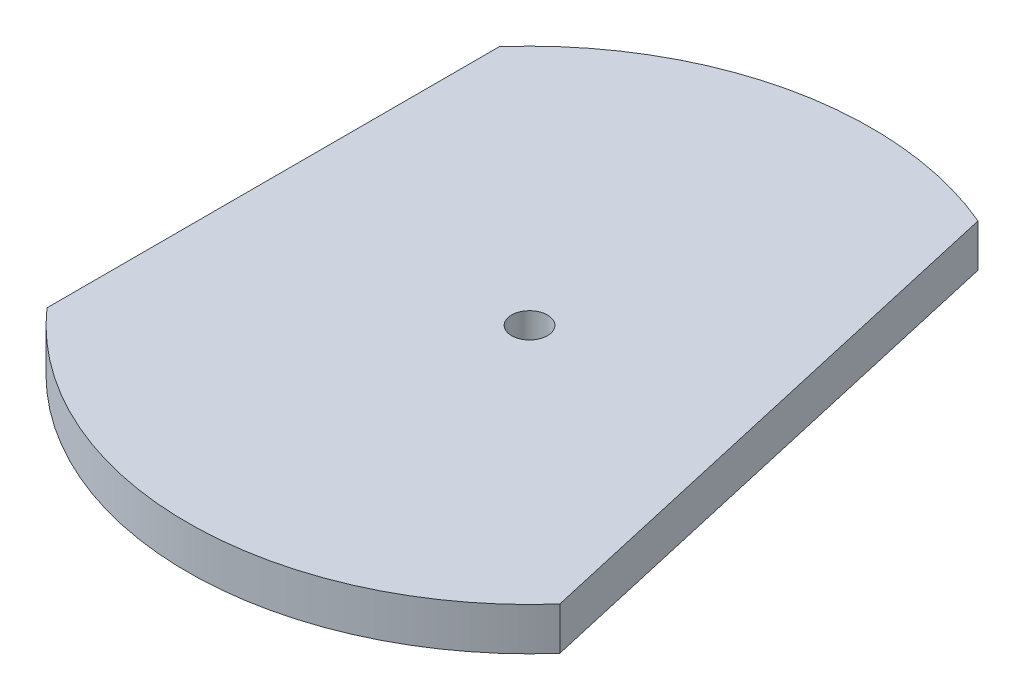
from build123d import *

# Parameters (mm, degrees)
SKETCH1_R           = 50.8
SKETCH1_R_2         = 2.666666667
BOSS_EXTRUDE1_DEPTH = 6.35
CUT_EXTRUDE1_START  = -12.7
CUT_EXTRUDE1_DEPTH  = 12.7
CUT_EXTRUDE2_START  = -17.348
CUT_EXTRUDE2_DEPTH  = 17.348


with BuildPart() as part:
    # Sketch1 → Boss-Extrude1 (new body)
    with BuildSketch(Plane(origin=(0, 0, 0), x_dir=(1, 0, 0), z_dir=(0, 1, 0))):
        with Locations(Location((0, 0, 0), (0, 0, 270))):
            Circle(SKETCH1_R)
        with Locations(Location((0, 0, 0), (0, 0, 270))):
            Circle(SKETCH1_R_2, mode=Mode.SUBTRACT)
    extrude(amount=BOSS_EXTRUDE1_DEPTH)

    # Sketch2 → Cut-Extrude1 (cut)
    with BuildSketch(Plane(origin=(0, 6.35, 0), x_dir=(1, 0, 0), z_dir=(0, 1, 0)).offset(CUT_EXTRUDE1_START)):
        with BuildLine():
            ThreePointArc((50.8, 0), (47.519048812, 17.960512242), (38.1, 33.601041651))
            Line((38.1, 33.601041651), (38.1, 0))
            Line((38.1, 0), (38.1, -33.601041651))
            ThreePointArc((38.1, -33.601041651), (47.519048812, -17.960512242), (50.8, 0))
        make_face()
        with BuildLine():
            ThreePointArc((-38.1, 33.601041651), (-47.519048812, 17.960512242), (-50.8, 0))
            Line((-50.8, 0), (-38.1, 0))
            Line((-38.1, 0), (-38.1, 33.601041651))
        make_face()
        with BuildLine():
            Line((-38.1, 0), (-50.8, 0))
            ThreePointArc((-50.8, 0), (-47.519048812, -17.960512242), (-38.1, -33.601041651))
            Line((-38.1, -33.601041651), (-38.1, 0))
        make_face()
    extrude(amount=CUT_EXTRUDE1_DEPTH, mode=Mode.SUBTRACT)

    # Sketch3 → Cut-Extrude2 (cut)
    with BuildSketch(Plane(origin=(0, 6.35, 0), x_dir=(1, 0, 0), z_dir=(0, 1, 0)).offset(CUT_EXTRUDE2_START)):
        with BuildLine():
            Line((22.86, 33.601041651), (38.1, 33.601041651))
            ThreePointArc((38.1, 33.601041651), (29.725219859, 41.19528255), (19.87826087, 46.74927534))
            Line((19.87826087, 46.74927534), (22.86, 33.601041651))
        make_face()
        Polygon((38.1, 33.601041651), (22.86, 33.601041651), (38.1, -33.601041651), align=None)
    extrude(amount=CUT_EXTRUDE2_DEPTH, mode=Mode.SUBTRACT)


solid = part.part
